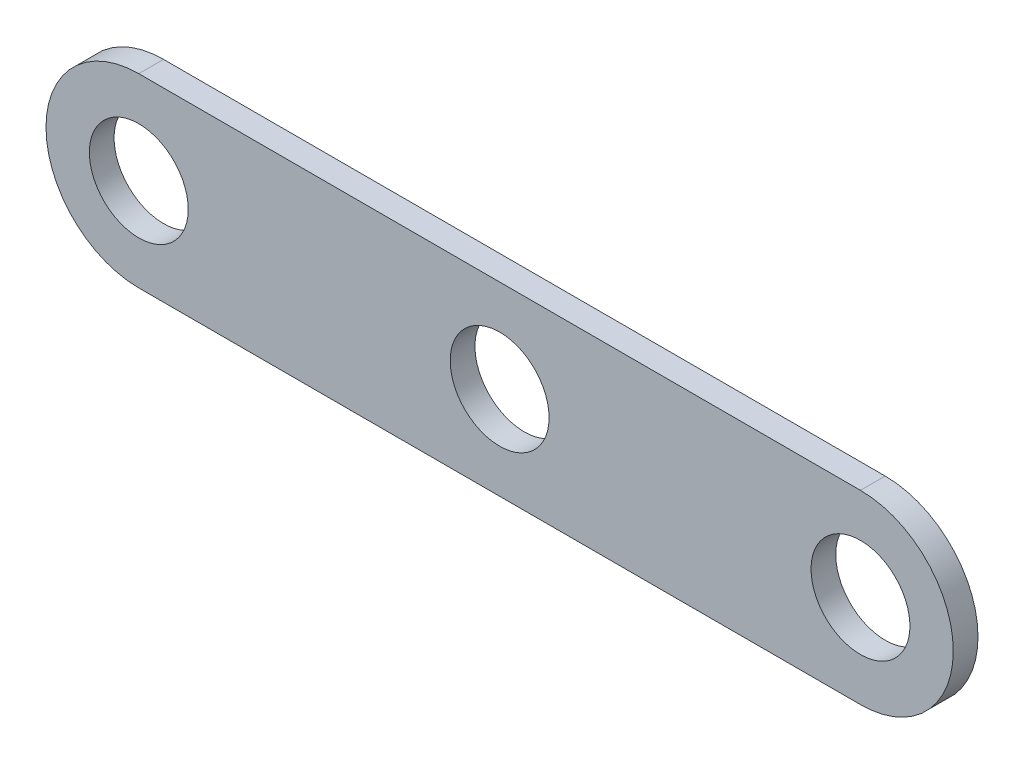
from build123d import *

# Parameters (mm, degrees)
SKETCH2_R           = 11.99
BOSS_EXTRUDE1_DEPTH = 6


with BuildPart() as part:
    # Sketch2 → Boss-Extrude1 (new body)
    with BuildSketch(Plane.XY):
        with BuildLine():
            Line((-87.5, -22.5), (87.5, -22.5))
            ThreePointArc((87.5, -22.5), (110, 0), (87.5, 22.5))
            Line((87.5, 22.5), (-87.5, 22.5))
            ThreePointArc((-87.5, 22.5), (-110, 0), (-87.5, -22.5))
        make_face()
        with Locations((-87.5, 0)):
            Circle(SKETCH2_R, mode=Mode.SUBTRACT)
        with Locations(Location((87.5, 0, 0), (0, 0, 180))):
            Circle(SKETCH2_R, mode=Mode.SUBTRACT)
        Circle(SKETCH2_R, mode=Mode.SUBTRACT)
    extrude(amount=BOSS_EXTRUDE1_DEPTH)


solid = part.part
